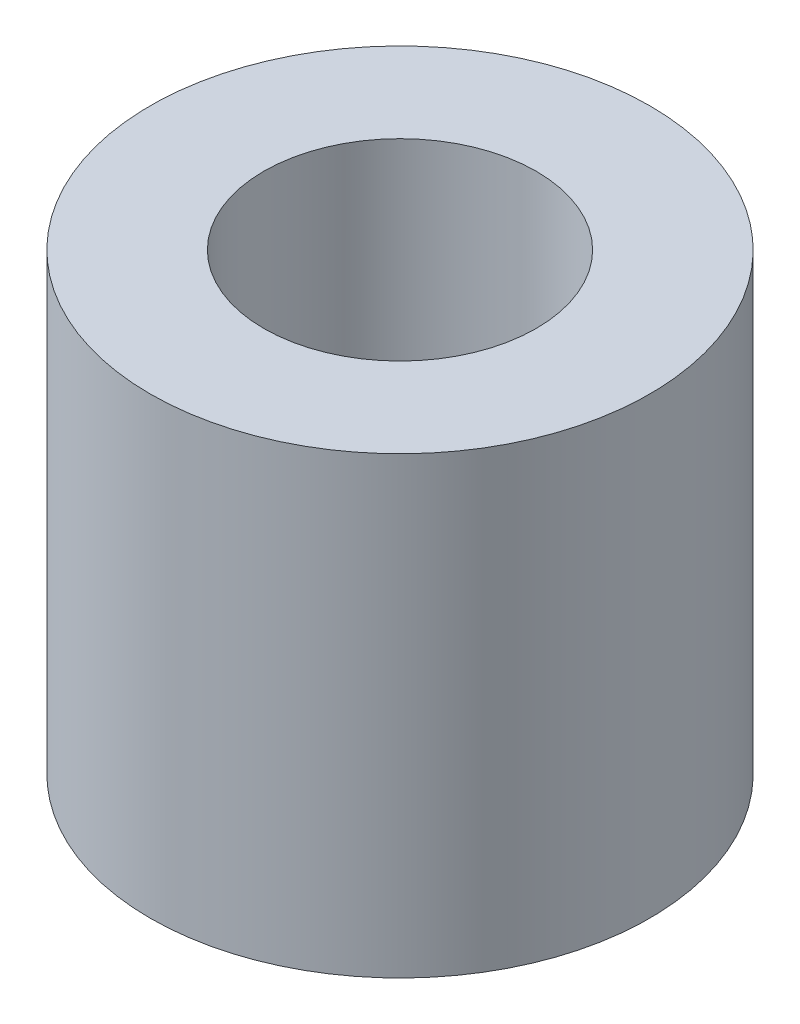
from build123d import *

# Parameters (mm, degrees)
SKETCH1_R           = 2.75
STANDOFF_BODY_DEPTH = 5
M3_BORE_DEPTH       = 7.33442973
M3_BORE_DEPTH_BACK  = 7.33442973
SKETCH2_R           = 1.5


with BuildPart() as part:
    # Sketch1 → Standoff_body (new body)
    with BuildSketch(Plane(origin=(0, 0, 0), x_dir=(1, 0, 0), z_dir=(0, 1, 0))):
        with Locations(Location((0, 0, 0), (0, 0, 270))):
            Circle(SKETCH1_R)
    extrude(amount=STANDOFF_BODY_DEPTH)

    # Sketch2 → M3_bore (cut, two sides: drawn at the far end of the back side and taken through both)
    with BuildSketch(Plane(origin=(0, 0, 0), x_dir=(1, 0, 0), z_dir=(0, 1, 0)).offset(-M3_BORE_DEPTH_BACK)):
        with Locations(Location((0, 0, 0), (0, 0, 270))):
            Circle(SKETCH2_R)
    extrude(amount=M3_BORE_DEPTH + M3_BORE_DEPTH_BACK, mode=Mode.SUBTRACT)


solid = part.part
